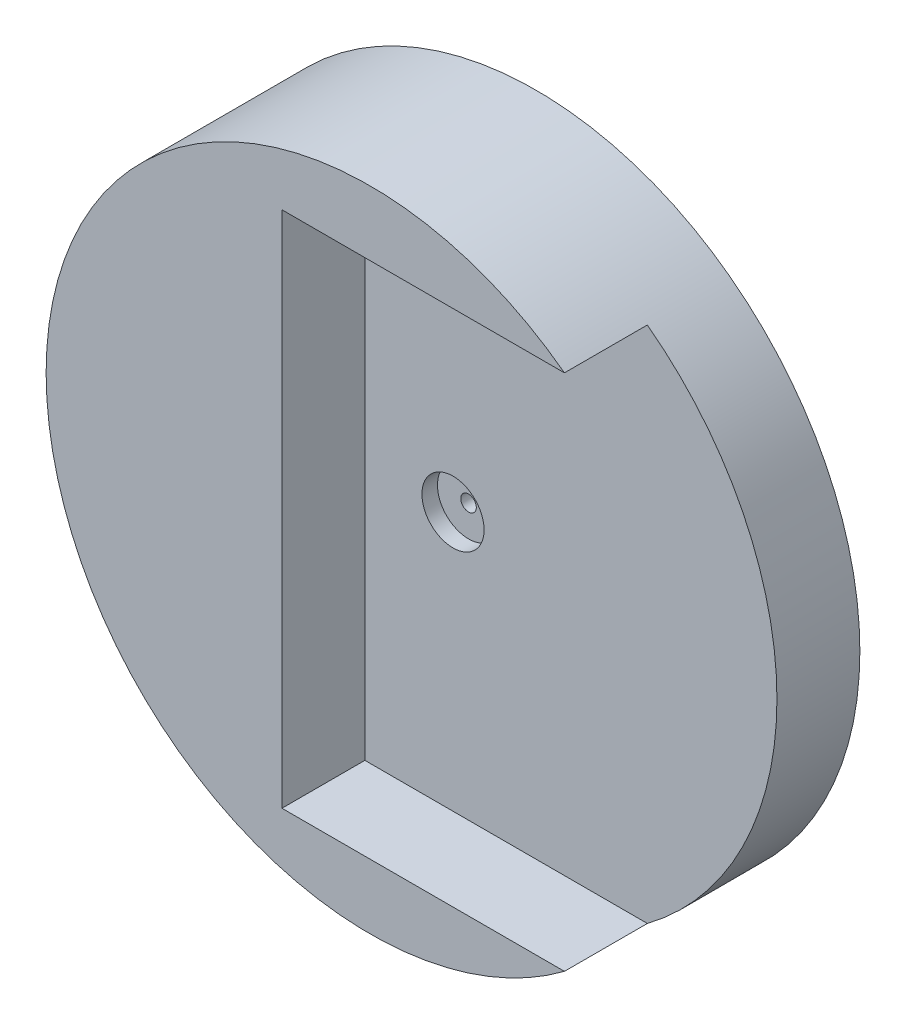
from build123d import *

# Parameters (mm, degrees)
SKETCH1_R           = 62.5
SKETCH1_R_2         = 57.5
BOSS_EXTRUDE1_DEPTH = 10
SKETCH2_R           = 62.5
BOSS_EXTRUDE2_DEPTH = 22
SKETCH3_R           = 1.5
CUT_EXTRUDE1_DEPTH  = 92.08512502
SKETCH4_W           = 100
SKETCH4_H           = 100
CUT_EXTRUDE2_DEPTH  = 16
SKETCH6_R           = 6
CUT_EXTRUDE3_DEPTH  = 3


with BuildPart() as part:
    # Sketch1 → Boss-Extrude1 (new body)
    with BuildSketch(Plane.XY):
        Circle(SKETCH1_R)
        Circle(SKETCH1_R_2, mode=Mode.SUBTRACT)
    extrude(amount=BOSS_EXTRUDE1_DEPTH)

    # Sketch2 → Boss-Extrude2 (add)
    with BuildSketch(Plane.XY.offset(10)):
        Circle(SKETCH2_R)
    extrude(amount=BOSS_EXTRUDE2_DEPTH)

    # Sketch3 → Cut-Extrude1 (cut, through all)
    with BuildSketch(Plane(origin=(0, 0, 10), x_dir=(-1, 0, 0), z_dir=(0, 0, -1))):
        Circle(SKETCH3_R)
    extrude(amount=-CUT_EXTRUDE1_DEPTH, mode=Mode.SUBTRACT)

    # Sketch4 → Cut-Extrude2 (cut)
    with BuildSketch(Plane.XY.offset(32)):
        with Locations((33, 0)):
            Rectangle(SKETCH4_W, SKETCH4_H)
    extrude(amount=-CUT_EXTRUDE2_DEPTH, mode=Mode.SUBTRACT)

    # Sketch6 → Cut-Extrude3 (cut)
    with BuildSketch(Plane.XY.offset(16)):
        Circle(SKETCH6_R)
    extrude(amount=-CUT_EXTRUDE3_DEPTH, mode=Mode.SUBTRACT)


solid = part.part
